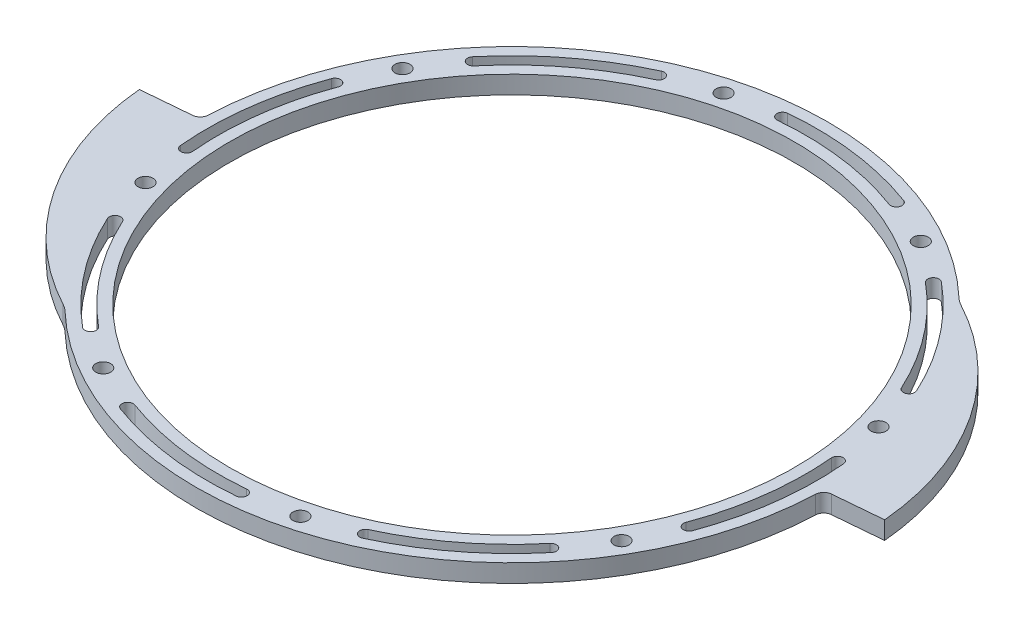
from build123d import *

# Parameters (mm, degrees)
SKETCH1_R                = 100
BOSS_EXTRUDE1_DEPTH      = 3.175
FILLET1_R                = 3
CIRPATTERN1_COUNT        = 2
FILLET1_OF_CIRPATTERN1_R = 3
SKETCH2_R                = 2.65
CUT_EXTRUDE1_DEPTH       = 174.229104079
CIRPATTERN2_COUNT        = 8
LIGHTENING_CUT_DEPTH     = 174.229104079
LIGHTENING_PATTERN_COUNT = 8


with BuildPart() as part:
    # Sketch1 → Boss-Extrude1 (new, symmetric)
    with BuildSketch(Plane(origin=(0, 0, 0), x_dir=(1, 0, 0), z_dir=(0, 1, 0))):
        with BuildLine():
            Line((-111.986312116, 1.750970805), (-132, 0))
            ThreePointArc((-132, 0), (-115.815804966, -46.398149165), (-79.477414809, -79.477414809))
            ThreePointArc((-79.477414809, -79.477414809), (-78.32708198, -80.19539315), (-77.284459499, -81.062397694))
            ThreePointArc((-77.284459499, -81.062397694), (103.297481806, 43.285450818), (-111.986312116, 1.750970805))
        make_face()
        with Locations(Location((0, 0, 0), (0, 0, 270))):
            Circle(SKETCH1_R, mode=Mode.SUBTRACT)
    boss_extrude1 = extrude(amount=BOSS_EXTRUDE1_DEPTH, both=True)

    # Fillet1
    fillet1_edges = [part.edges().sort_by_distance(p)[0] for p in [
        (-111.986312116, 0, -1.750970805),
    ]]
    fillet(fillet1_edges, radius=FILLET1_R)

    # CirPattern1: Boss-Extrude1 ×2 about axis
    cirpattern1_axis = Axis((0, 0, 0), (0, 1, 0))
    for i in range(1, CIRPATTERN1_COUNT):
        add(boss_extrude1.rotate(cirpattern1_axis, i * 360 / CIRPATTERN1_COUNT))

    # Fillet1 of CirPattern1
    fillet1_of_cirpattern1_edges = [part.edges().sort_by_distance(p)[0] for p in [
        (111.986312116, 0, 1.750970805),
    ]]
    fillet(fillet1_of_cirpattern1_edges, radius=FILLET1_OF_CIRPATTERN1_R)

    # Sketch2 → Cut-Extrude1 (cut, through all)
    with BuildSketch(Plane(origin=(0, 3.175, 0), x_dir=(1, 0, 0), z_dir=(0, 1, 0))):
        with Locations(Location((-102.388137587, -27.434818781, 0), (0, 0, 270))):
            Circle(SKETCH2_R)
    cut_extrude1 = extrude(amount=-CUT_EXTRUDE1_DEPTH, mode=Mode.SUBTRACT)

    # CirPattern2: Cut-Extrude1 ×8 about axis
    cirpattern2_axis = Axis((0, 0, 0), (0, 1, 0))
    for i in range(1, CIRPATTERN2_COUNT):
        add(cut_extrude1.rotate(cirpattern2_axis, i * 360 / CIRPATTERN2_COUNT), mode=Mode.SUBTRACT)

    # Sketch3 → Lightening Cut (cut, through all)
    with BuildSketch(Plane(origin=(0, 3.175, 0), x_dir=(1, 0, 0), z_dir=(0, 1, 0))):
        with BuildLine():
            ThreePointArc((-101.318921825, 37.396204088), (-107.076045028, 14.09682876), (-107.545413115, -9.898692736))
            ThreePointArc((-107.545413115, -9.898692736), (-105.370522266, -11.706965335), (-103.562249667, -9.532074486))
            ThreePointArc((-103.562249667, -9.532074486), (-103.110265583, 13.574723991), (-97.566369165, 36.011159492))
            ThreePointArc((-97.566369165, 36.011159492), (-98.750123197, 38.57995812), (-101.318921825, 37.396204088))
        make_face()
    lightening_cut = extrude(amount=-LIGHTENING_CUT_DEPTH, mode=Mode.SUBTRACT)

    # Lightening Pattern: Lightening Cut ×8 about axis
    lightening_pattern_axis = Axis((0, 0, 0), (0, 1, 0))
    for i in range(1, LIGHTENING_PATTERN_COUNT):
        add(lightening_cut.rotate(lightening_pattern_axis, i * 360 / LIGHTENING_PATTERN_COUNT), mode=Mode.SUBTRACT)


solid = part.part
